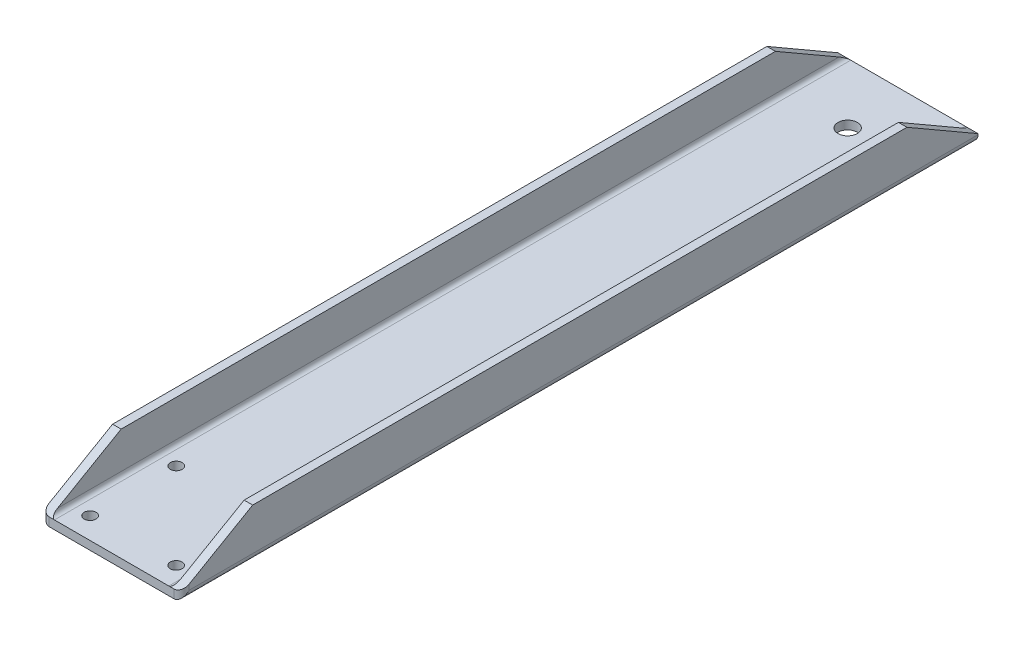
from build123d import *

# Parameters (mm, degrees)
BOSS_EXTRUDE1_DEPTH  = 370
CUT_EXTRUDE1_DEPTH   = 377.385766877
M5_CLEARANCE_HOLE1_D = 5.5
M8_CLEARANCE_HOLE1_D = 9
FILLET1_R            = 2
FILLET2_R            = 3.5
CUT_EXTRUDE2_DEPTH   = 373.141046534


with BuildPart() as part:
    # Sketch1 → Boss-Extrude1 (new body)
    with BuildSketch(Plane.XY):
        Polygon((-28.575, 23.01875), (-32.54375, 23.01875), (-32.54375, 0), (32.54375, 0), (32.54375, 23.01875), (28.575, 23.01875), (28.575, 3.96875), (-28.575, 3.96875), align=None)
    extrude(amount=BOSS_EXTRUDE1_DEPTH)

    # Sketch2 → Cut-Extrude1 (cut, through all)
    with BuildSketch(Plane.ZY.offset(32.54375)):
        Polygon((0, 3.96875), (32.995567884, 23.01875), (0, 23.01875), align=None)
        Polygon((370, 23.01875), (370, 3.96875), (337.004432116, 23.01875), align=None)
    extrude(amount=-CUT_EXTRUDE1_DEPTH, mode=Mode.SUBTRACT)

    # M5 Clearance Hole1 (through all)
    with Locations(Plane(origin=(0, 3.96875, 0), x_dir=(1, 0, 0), z_dir=(0, 1, 0))):
        with Locations((20, -360), (20, -320), (-20, -320), (-20, -360)):
            Hole(M5_CLEARANCE_HOLE1_D / 2)

    # M8 Clearance Hole1 (through all)
    with Locations(Plane(origin=(0, 3.96875, 0), x_dir=(1, 0, 0), z_dir=(0, 1, 0))):
        with Locations((0, -28)):
            Hole(M8_CLEARANCE_HOLE1_D / 2)

    # Fillet1
    fillet1_edges = [part.edges().sort_by_distance(p)[0] for p in [
        (28.575, 3.96875, 185),
        (-28.575, 3.96875, 185),
    ]]
    fillet(fillet1_edges, radius=FILLET1_R)

    # Fillet2
    fillet2_edges = [part.edges().sort_by_distance(p)[0] for p in [
        (32.54375, 0, 185),
        (-32.54375, 0, 185),
    ]]
    fillet(fillet2_edges, radius=FILLET2_R)

    # Sketch8 → Cut-Extrude2 (cut, through all)
    with BuildSketch(Plane.XZ):
        with BuildLine():
            Line((-32.54375, 366.5), (-32.54375, 370))
            Line((-32.54375, 370), (-29.04375, 370))
            ThreePointArc((-29.04375, 370), (-31.518623734, 368.974873734), (-32.54375, 366.5))
        make_face()
        with BuildLine():
            Line((29.04375, 370), (32.54375, 370))
            Line((32.54375, 370), (32.54375, 366.5))
            ThreePointArc((32.54375, 366.5), (31.518623734, 368.974873734), (29.04375, 370))
        make_face()
    extrude(amount=-CUT_EXTRUDE2_DEPTH, mode=Mode.SUBTRACT)


solid = part.part
